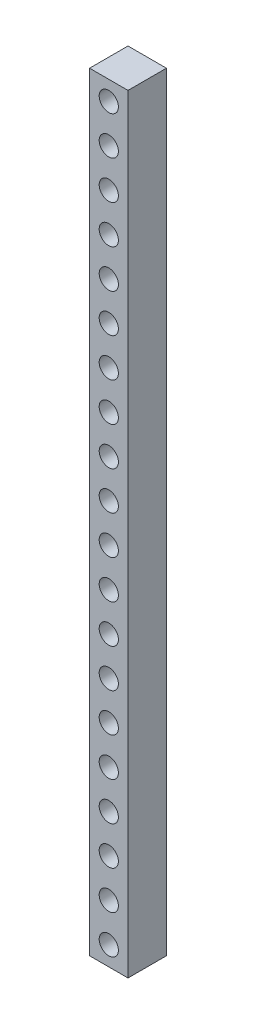
from build123d import *

# Parameters (mm, degrees)
ESQUISSE1_W = 10
ESQUISSE1_H = 200
ESQUISSE1_R = 2.5
BASE_DEPTH  = 10


with BuildPart() as part:
    # Esquisse1 → BASE (new body)
    with BuildSketch(Plane.XY):
        Rectangle(ESQUISSE1_W, ESQUISSE1_H)
        with Locations((0, 95)):
            Circle(ESQUISSE1_R, mode=Mode.SUBTRACT)
        with Locations((0, 85)):
            Circle(ESQUISSE1_R, mode=Mode.SUBTRACT)
        with Locations((0, 75)):
            Circle(ESQUISSE1_R, mode=Mode.SUBTRACT)
        with Locations((0, 65)):
            Circle(ESQUISSE1_R, mode=Mode.SUBTRACT)
        with Locations((0, 55)):
            Circle(ESQUISSE1_R, mode=Mode.SUBTRACT)
        with Locations((0, 45)):
            Circle(ESQUISSE1_R, mode=Mode.SUBTRACT)
        with Locations((0, 35)):
            Circle(ESQUISSE1_R, mode=Mode.SUBTRACT)
        with Locations((0, 25)):
            Circle(ESQUISSE1_R, mode=Mode.SUBTRACT)
        with Locations((0, 15)):
            Circle(ESQUISSE1_R, mode=Mode.SUBTRACT)
        with Locations((0, 5)):
            Circle(ESQUISSE1_R, mode=Mode.SUBTRACT)
        with Locations((0, -5)):
            Circle(ESQUISSE1_R, mode=Mode.SUBTRACT)
        with Locations((0, -15)):
            Circle(ESQUISSE1_R, mode=Mode.SUBTRACT)
        with Locations((0, -25)):
            Circle(ESQUISSE1_R, mode=Mode.SUBTRACT)
        with Locations((0, -35)):
            Circle(ESQUISSE1_R, mode=Mode.SUBTRACT)
        with Locations((0, -45)):
            Circle(ESQUISSE1_R, mode=Mode.SUBTRACT)
        with Locations((0, -55)):
            Circle(ESQUISSE1_R, mode=Mode.SUBTRACT)
        with Locations((0, -65)):
            Circle(ESQUISSE1_R, mode=Mode.SUBTRACT)
        with Locations((0, -75)):
            Circle(ESQUISSE1_R, mode=Mode.SUBTRACT)
        with Locations((0, -85)):
            Circle(ESQUISSE1_R, mode=Mode.SUBTRACT)
        with Locations((0, -95)):
            Circle(ESQUISSE1_R, mode=Mode.SUBTRACT)
    extrude(amount=BASE_DEPTH)


solid = part.part
